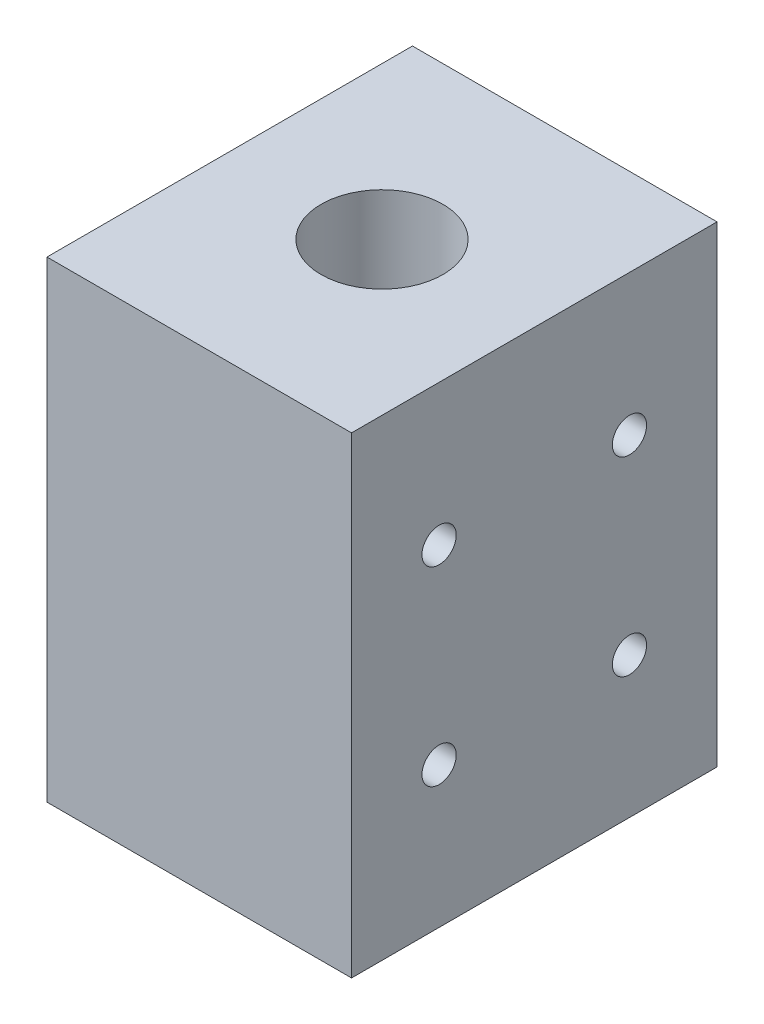
from build123d import *

# Parameters (mm, degrees)
CROQUIS1_W              = 40
CROQUIS1_H              = 48
CROQUIS1_R              = 8
SALIENTE_EXTRUIR1_DEPTH = 62
CROQUIS2_R              = 2.25
CORTAR_EXTRUIR1_DEPTH   = 30


with BuildPart() as part:
    # Croquis1 → Saliente-Extruir1 (new body)
    with BuildSketch(Plane(origin=(0, 0, 0), x_dir=(1, 0, 0), z_dir=(0, 1, 0))):
        Rectangle(CROQUIS1_W, CROQUIS1_H)
        with Locations(Location((0, 0, 0), (0, 0, 270))):
            Circle(CROQUIS1_R, mode=Mode.SUBTRACT)
    extrude(amount=SALIENTE_EXTRUIR1_DEPTH)

    # Croquis2 → Cortar-Extruir1 (cut)
    with BuildSketch(Plane(origin=(20, 0, 0), x_dir=(0, 0, -1), z_dir=(1, 0, 0))):
        with Locations((-12.5, 43.5)):
            Circle(CROQUIS2_R)
        with Locations((12.5, 43.5)):
            Circle(CROQUIS2_R)
        with Locations((-12.5, 18.5)):
            Circle(CROQUIS2_R)
        with Locations((12.5, 18.5)):
            Circle(CROQUIS2_R)
    extrude(amount=-CORTAR_EXTRUIR1_DEPTH, mode=Mode.SUBTRACT)


solid = part.part
